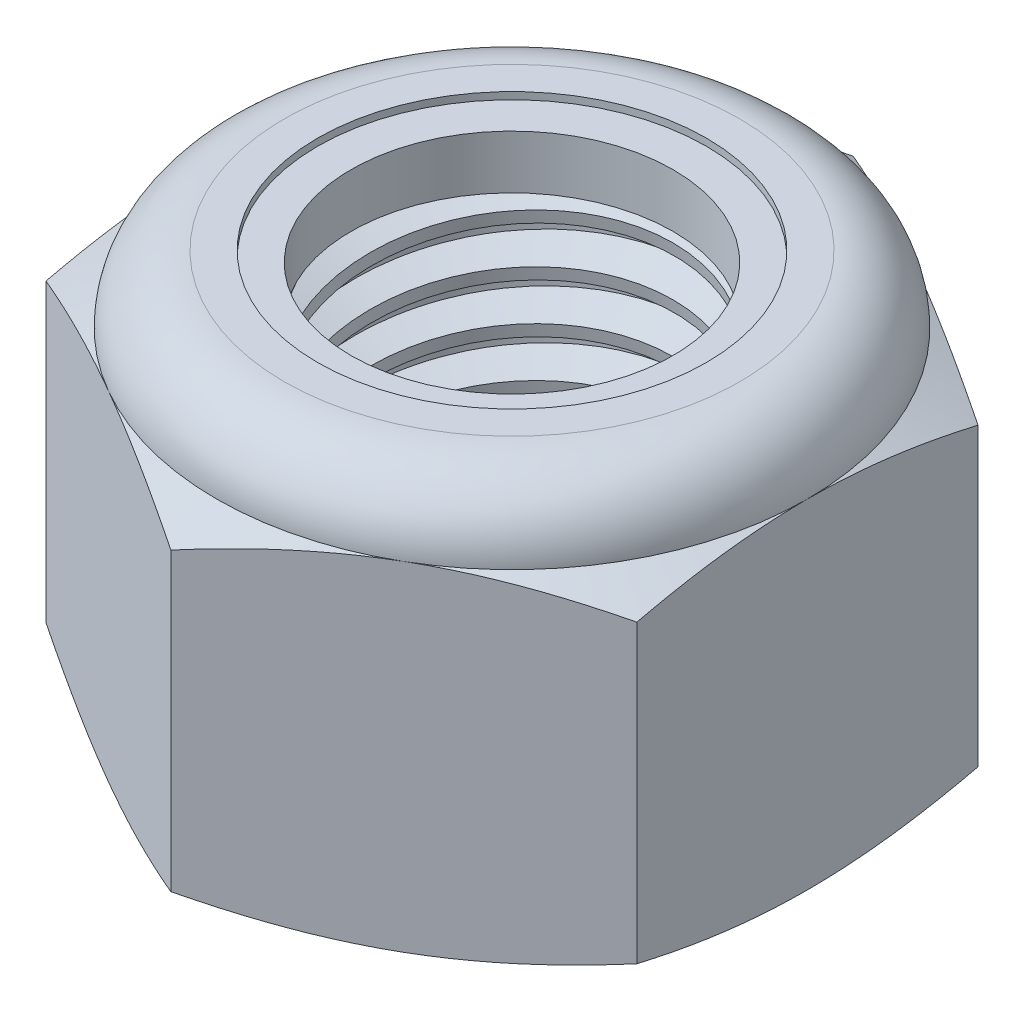
from build123d import *

# Parameters (mm, degrees)
EXTRUDE1_DEPTH      = 8.73125
SKETCH2_W           = 3.96875
SKETCH2_H           = 8.73125
LPATTERN1_COUNT     = 8
LPATTERN1_PITCH     = 1.058333333
LPATTERN1_COL_COUNT = 2
LPATTERN1_COL_PITCH = 1.058333333


with BuildPart() as part:
    # Sketch1 → Extrude1 (new body)
    with BuildSketch(Plane(origin=(0, 0, 0), x_dir=(1, 0, 0), z_dir=(0, 1, 0))):
        Polygon((0, 7.332348419), (-6.35, 3.666174209), (-6.35, -3.666174209), (0, -7.332348419), (6.35, -3.666174209), (6.35, 3.666174209), align=None)
    extrude(amount=EXTRUDE1_DEPTH)

    # Sketch4 → Cut-Revolve2 (revolve, cut)
    with BuildSketch(Plane(origin=(0, 0, 0), x_dir=(0, 0, -1), z_dir=(1, 0, 0)), mode=Mode.PRIVATE) as cut_revolve2_sk:
        Polygon((0, 8.73125), (3.96875, 8.73125), (3.462129843, 8.495009141), (3.462129843, 0.236240859), (3.96875, 0), (0, 0), align=None)
    revolve(cut_revolve2_sk.sketch.rotate(Axis((0, 8.73125, 0), (0, 1, 0)), 54.866222378), axis=Axis((0, 8.73125, 0), (0, 1, 0)), mode=Mode.SUBTRACT)


with BuildPart() as body_2:
    # Sketch2 → Revolve1 (revolve)
    with BuildSketch(Plane(origin=(0, 0, 0), x_dir=(0, 0, -1), z_dir=(1, 0, 0))):
        with Locations((1.984375, 4.365625)):
            Rectangle(SKETCH2_W, SKETCH2_H)
    revolve(axis=Axis((0, -3.96875, 0), (0, 1, 0)))

    # Sketch3 → Cut-Revolve1 (revolve, cut)
    with BuildSketch(Plane(origin=(0, 0, 0), x_dir=(0, 0, -1), z_dir=(1, 0, 0)), mode=Mode.PRIVATE) as cut_revolve1_sk:
        Polygon((3.986234159, 8.600118809), (4.10862327, 7.682200472), (3.49709816, 7.934319821), (3.462129843, 8.196582203), align=None)
    cut_revolve1 = revolve(cut_revolve1_sk.sketch.rotate(Axis((0, 8.73125, 0.150633003), (0, -0.9912279006826347, -0.1321637200910183)), 180), axis=Axis((0, 8.73125, 0.150633003), (0, -0.9912279006826347, -0.1321637200910183)), mode=Mode.SUBTRACT)

    # LPattern1: Cut-Revolve1 ×8
    with Locations(*[(0, -i * LPATTERN1_PITCH, 0) for i in range(1, LPATTERN1_COUNT)]):
        add(cut_revolve1, mode=Mode.SUBTRACT)

    # LPattern1 col: Cut-Revolve1 ×2
    with Locations(*[(0, i * LPATTERN1_COL_PITCH, 0) for i in range(1, LPATTERN1_COL_COUNT)]):
        add(cut_revolve1, mode=Mode.SUBTRACT)


with BuildPart() as part_1:
    add(part.part)

    # Combine1: cut body 2
    add(body_2.part, mode=Mode.SUBTRACT)

    # Sketch5 → Cut-Revolve3 (revolve, cut)
    with BuildSketch(Plane(origin=(0, 0, 0), x_dir=(0, 0, -1), z_dir=(1, 0, 0)), mode=Mode.PRIVATE) as cut_revolve3_sk:
        with BuildLine():
            Line((0, 0), (6.35, 0))
            Line((6.35, 0), (7.332348419, 0.458076591))
            Line((7.332348419, 0.458076591), (7.332348419, 6.817965076))
            Line((7.332348419, 6.817965076), (6.35, 7.276041667))
            ThreePointArc((6.35, 7.276041667), (5.923779347, 8.305029347), (4.894791667, 8.73125))
            Line((4.894791667, 8.73125), (4.894791667, 10.00125))
            Line((4.894791667, 10.00125), (8.602348419, 10.00125))
            Line((8.602348419, 10.00125), (8.602348419, -1.27))
            Line((8.602348419, -1.27), (0, -1.27))
            Line((0, -1.27), (0, 0))
        make_face()
    revolve(cut_revolve3_sk.sketch.rotate(Axis((0, 0, 0), (0, 1, 0)), 54.866222378), axis=Axis((0, 0, 0), (0, 1, 0)), mode=Mode.SUBTRACT)

    # Sketch6 → Cut-Revolve4 (revolve, cut)
    with BuildSketch(Plane(origin=(0, 0, 0), x_dir=(0, 0, -1), z_dir=(1, 0, 0)), mode=Mode.PRIVATE) as cut_revolve4_sk:
        with BuildLine():
            Line((0, 7.276041667), (6.1976, 7.276041667))
            ThreePointArc((6.1976, 7.276041667), (5.816016274, 8.197266274), (4.894791667, 8.57885))
            Line((4.894791667, 8.57885), (4.178460755, 8.57885))
            Line((4.178460755, 8.57885), (4.178460755, 10.00125))
            Line((4.178460755, 10.00125), (0, 10.00125))
            Line((0, 10.00125), (0, 7.276041667))
        make_face()
    revolve(cut_revolve4_sk.sketch.rotate(Axis((0, 10.00125, 0), (0, 1, 0)), 54.866222378), axis=Axis((0, 10.00125, 0), (0, 1, 0)), mode=Mode.SUBTRACT)


with BuildPart() as body_2_2:
    # Sketch7 → Revolve2 (revolve)
    with BuildSketch(Plane(origin=(0, 0, 0), x_dir=(0, 0, -1), z_dir=(1, 0, 0)), mode=Mode.PRIVATE) as revolve2_sk:
        with BuildLine():
            Line((3.462129843, 7.352241667), (6.119030844, 7.352241667))
            ThreePointArc((6.119030844, 7.352241667), (5.734762038, 8.169919611), (4.894791667, 8.50265))
            Line((4.894791667, 8.50265), (3.462129843, 8.50265))
            Line((3.462129843, 8.50265), (3.462129843, 7.352241667))
        make_face()
    revolve(revolve2_sk.sketch.rotate(Axis((0, 7.352241667, 0), (0, 1, 0)), 54.866222378), axis=Axis((0, 7.352241667, 0), (0, 1, 0)))


solid = Compound([part_1.part, body_2_2.part])
